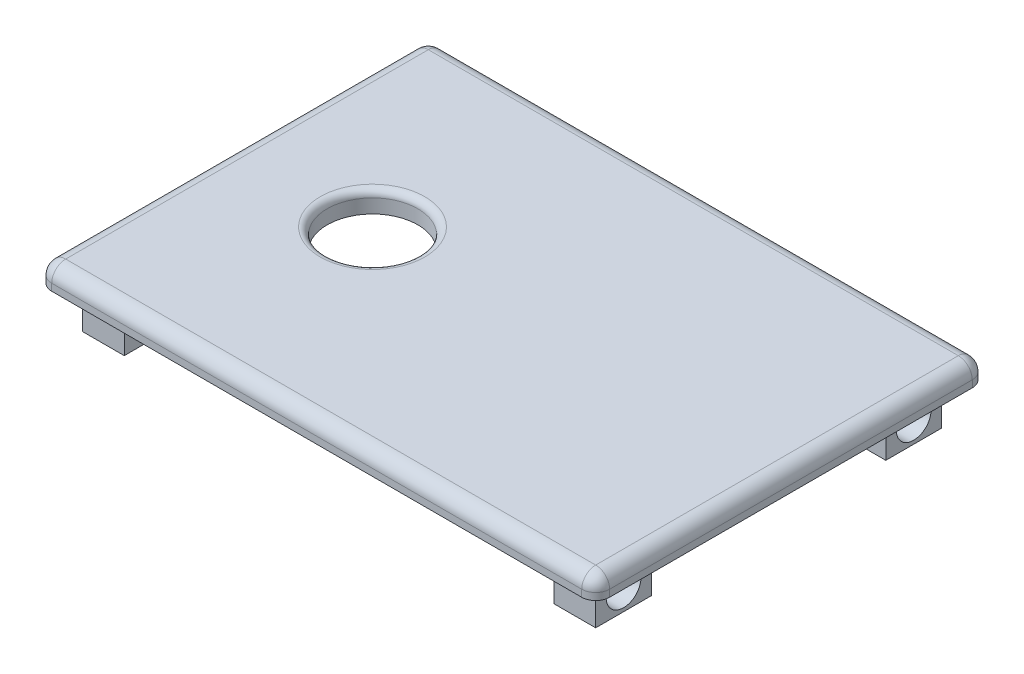
from build123d import *

# Parameters (mm, degrees)
SKETCH1_R           = 6.5
BOSS_EXTRUDE1_DEPTH = 3
FILLET1_R           = 2
SKETCH3_W           = 74
SKETCH3_H           = 50
SKETCH3_W_2         = 72
SKETCH3_H_2         = 48
BOSS_EXTRUDE2_DEPTH = 3
SKETCH4_W           = 74
SKETCH4_H           = 50
SKETCH4_W_2         = 73.6
SKETCH4_H_2         = 49.6
CUT_EXTRUDE1_DEPTH  = 3
FILLET2_R           = 1
SKETCH6_W           = 6
SKETCH6_H           = 8
BOSS_EXTRUDE3_DEPTH = 6
SKETCH7_R           = 2.5
CUT_EXTRUDE2_DEPTH  = 89.047516081


with BuildPart() as part:
    # Sketch1 → Boss-Extrude1 (new body)
    with BuildSketch(Plane(origin=(0, 0, 0), x_dir=(1, 0, 0), z_dir=(0, 1, 0))):
        with BuildLine():
            Line((-47.886115273, 42.639478046), (28.113884727, 42.639478046))
            ThreePointArc((28.113884727, 42.639478046), (29.528098289, 42.053691608), (30.113884727, 40.639478046))
            Line((30.113884727, 40.639478046), (30.113884727, -11.360521954))
            ThreePointArc((30.113884727, -11.360521954), (29.528098289, -12.774735517), (28.113884727, -13.360521954))
            Line((28.113884727, -13.360521954), (-47.886115273, -13.360521954))
            ThreePointArc((-47.886115273, -13.360521954), (-49.300328836, -12.774735517), (-49.886115273, -11.360521954))
            Line((-49.886115273, -11.360521954), (-49.886115273, 40.639478046))
            ThreePointArc((-49.886115273, 40.639478046), (-49.300328836, 42.053691608), (-47.886115273, 42.639478046))
        make_face()
        with Locations(Location((-29.886115273, 14.639478046, 0), (0, 0, 270))):
            Circle(SKETCH1_R, mode=Mode.SUBTRACT)
    extrude(amount=BOSS_EXTRUDE1_DEPTH)

    # Fillet1
    fillet1_edges = [part.edges().sort_by_distance(p)[0] for p in [
        (29.528098289, 3, -42.053691608),
        (-9.886115273, 3, -42.639478046),
        (-49.300328836, 3, -42.053691608),
        (-49.886115273, 3, -14.639478046),
        (-49.300328836, 3, 12.774735517),
        (-9.886115273, 3, 13.360521954),
        (29.528098289, 3, 12.774735517),
        (30.113884727, 3, -14.639478046),
    ]]
    fillet(fillet1_edges, radius=FILLET1_R)

    # Sketch3 → Boss-Extrude2 (add)
    with BuildSketch(Plane.XZ):
        with Locations((-9.886115273, -14.639478046)):
            Rectangle(SKETCH3_W, SKETCH3_H)
        with Locations((-9.886115273, -14.639478046)):
            Rectangle(SKETCH3_W_2, SKETCH3_H_2, mode=Mode.SUBTRACT)
    extrude(amount=BOSS_EXTRUDE2_DEPTH)

    # Sketch4 → Cut-Extrude1 (cut)
    with BuildSketch(Plane.XZ.offset(3)):
        with Locations((-9.886115273, -14.639478046)):
            Rectangle(SKETCH4_W, SKETCH4_H)
        with Locations((-9.886115273, -14.639478046)):
            Rectangle(SKETCH4_W_2, SKETCH4_H_2, mode=Mode.SUBTRACT)
    extrude(amount=-CUT_EXTRUDE1_DEPTH, mode=Mode.SUBTRACT)

    # Fillet2
    fillet2_edges = [part.edges().sort_by_distance(p)[0] for p in [
        (-29.886115273, 3, -21.139478046),
    ]]
    fillet(fillet2_edges, radius=FILLET2_R)

    # Sketch6 → Boss-Extrude3 (add)
    with BuildSketch(Plane.XZ):
        with Locations((-43.686115273, 6.160521954)):
            Rectangle(SKETCH6_W, SKETCH6_H)
        with Locations((23.913884727, 6.160521954)):
            Rectangle(SKETCH6_W, SKETCH6_H)
        with Locations((23.913884727, -35.439478046)):
            Rectangle(SKETCH6_W, SKETCH6_H)
        with Locations((-43.686115273, -35.439478046)):
            Rectangle(SKETCH6_W, SKETCH6_H)
    extrude(amount=BOSS_EXTRUDE3_DEPTH)

    # Sketch7 → Cut-Extrude2 (cut, through all)
    with BuildSketch(Plane.ZY.offset(46.686115273)):
        with Locations((-35.439478046, -3)):
            Circle(SKETCH7_R)
        with Locations(Location((6.160521954, -3, 0), (0, 0, 180))):
            Circle(SKETCH7_R)
    extrude(amount=-CUT_EXTRUDE2_DEPTH, mode=Mode.SUBTRACT)


solid = part.part
